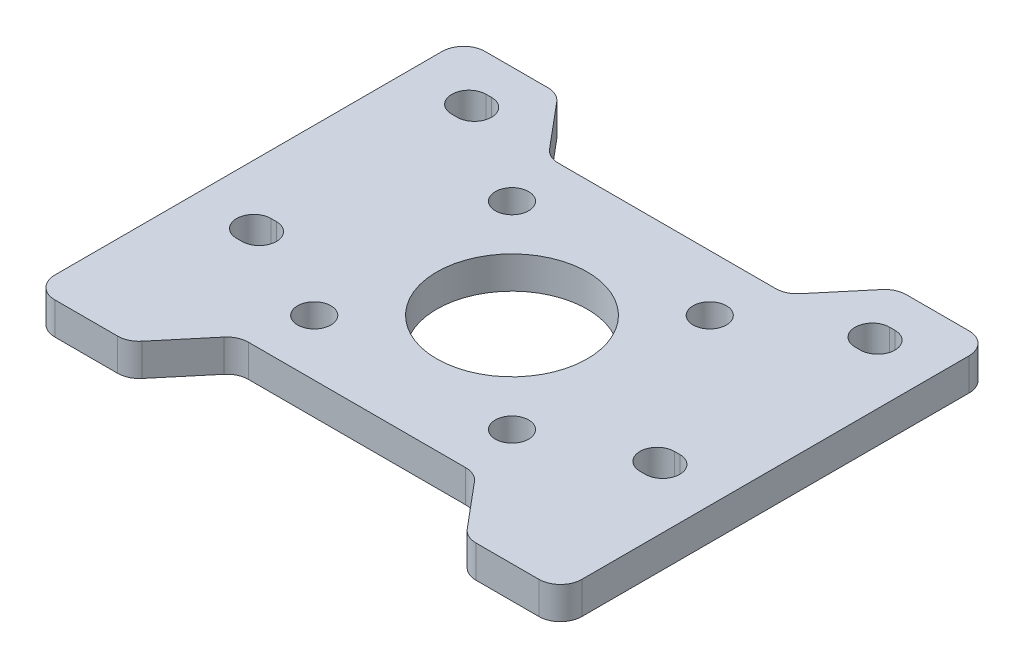
from build123d import *

# Parameters (mm, degrees)
SKETCH_1_W          = 49
SKETCH_1_H          = 40
EXTRUDE_1_DEPTH     = 3
SKETCH_2_R          = 1.55
SKETCH_2_R_2        = 7
CUT_EXTRUDE_1_DEPTH = 36.131894341
CUT_EXTRUDE_2_DEPTH = 36.131894341
FILLET_1_R          = 2


with BuildPart() as part:
    # 草图1 → 凸台-拉伸1 (new body)
    with BuildSketch(Plane(origin=(0, 0, 0), x_dir=(1, 0, 0), z_dir=(0, 1, 0))):
        with Locations((0, 5)):
            Rectangle(SKETCH_1_W, SKETCH_1_H)
        with BuildLine():
            Line((-19, 21.6), (-18.5, 21.6))
            ThreePointArc((-18.5, 21.6), (-16.9, 20), (-18.5, 18.4))
            Line((-18.5, 18.4), (-19, 18.4))
            ThreePointArc((-19, 18.4), (-20.6, 20), (-19, 21.6))
        make_face(mode=Mode.SUBTRACT)
        with BuildLine():
            Line((19, 18.4), (18.5, 18.4))
            ThreePointArc((18.5, 18.4), (16.9, 20), (18.5, 21.6))
            Line((18.5, 21.6), (19, 21.6))
            ThreePointArc((19, 21.6), (20.6, 20), (19, 18.4))
        make_face(mode=Mode.SUBTRACT)
        with BuildLine():
            Line((19, 1.6), (18.5, 1.6))
            ThreePointArc((18.5, 1.6), (16.9, 0), (18.5, -1.6))
            Line((18.5, -1.6), (19, -1.6))
            ThreePointArc((19, -1.6), (20.6, 0), (19, 1.6))
        make_face(mode=Mode.SUBTRACT)
        with BuildLine():
            Line((-19, -1.6), (-18.5, -1.6))
            ThreePointArc((-18.5, -1.6), (-16.9, 0), (-18.5, 1.6))
            Line((-18.5, 1.6), (-19, 1.6))
            ThreePointArc((-19, 1.6), (-20.6, 0), (-19, -1.6))
        make_face(mode=Mode.SUBTRACT)
    extrude(amount=EXTRUDE_1_DEPTH)

    # 草图2 → 切除-拉伸1 (cut, through all)
    with BuildSketch(Plane(origin=(0, 3, 0), x_dir=(1, 0, 0), z_dir=(0, 1, 0))):
        with Locations(Location((9.192388155, 14.192388155, 0), (0, 0, 270))):
            Circle(SKETCH_2_R)
        with Locations(Location((9.192388155, -4.192388155, 0), (0, 0, 90))):
            Circle(SKETCH_2_R)
        with Locations(Location((-9.192388155, 14.192388155, 0), (0, 0, 90))):
            Circle(SKETCH_2_R)
        with Locations(Location((-9.192388155, -4.192388155, 0), (0, 0, 270))):
            Circle(SKETCH_2_R)
        with Locations(Location((0, 5, 0), (0, 0, 270))):
            Circle(SKETCH_2_R_2)
    extrude(amount=-CUT_EXTRUDE_1_DEPTH, mode=Mode.SUBTRACT)

    # 草图3 → 切除-拉伸2 (cut, through all)
    with BuildSketch(Plane(origin=(0, 3, 0), x_dir=(1, 0, 0), z_dir=(0, 1, 0))):
        Polygon((-15.721322439, 25), (-11.036685955, 19.411212236), (11.036685955, 19.411212236), (15.721322439, 25), align=None)
        Polygon((15.721322439, -15), (11.036685955, -9.411212236), (-11.036685955, -9.411212236), (-15.721322439, -15), align=None)
    extrude(amount=-CUT_EXTRUDE_2_DEPTH, mode=Mode.SUBTRACT)

    # 圆角1
    fillet_1_edges = [part.edges().sort_by_distance(p)[0] for p in [
        (-15.721322439, 1.5, -25),
        (15.721322439, 1.5, -25),
        (11.036685955, 1.5, -19.411212236),
        (-11.036685955, 1.5, -19.411212236),
        (15.721322439, 1.5, 15),
        (-15.721322439, 1.5, 15),
        (-11.036685955, 1.5, 9.411212236),
        (11.036685955, 1.5, 9.411212236),
        (24.5, 1.5, 15),
        (-24.5, 1.5, 15),
        (-24.5, 1.5, -25),
        (24.5, 1.5, -25),
    ]]
    fillet(fillet_1_edges, radius=FILLET_1_R)


solid = part.part
